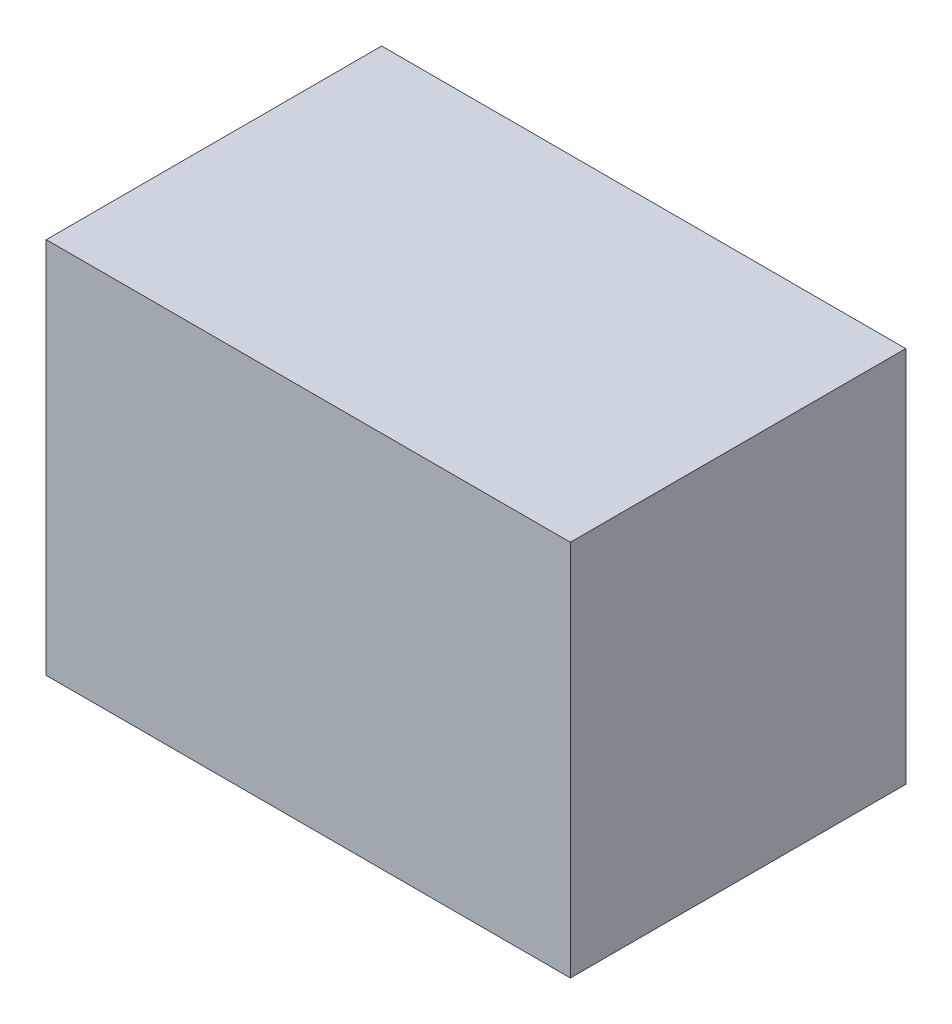
from build123d import *

# Parameters (mm, degrees)
SKETCH1_W           = 125
SKETCH1_H           = 80
BOSS_EXTRUDE1_DEPTH = 90


with BuildPart() as part:
    # Sketch1 → Boss-Extrude1 (new body)
    with BuildSketch(Plane(origin=(0, 0, 0), x_dir=(1, 0, 0), z_dir=(0, 1, 0))):
        Rectangle(SKETCH1_W, SKETCH1_H)
    extrude(amount=BOSS_EXTRUDE1_DEPTH)


solid = part.part
